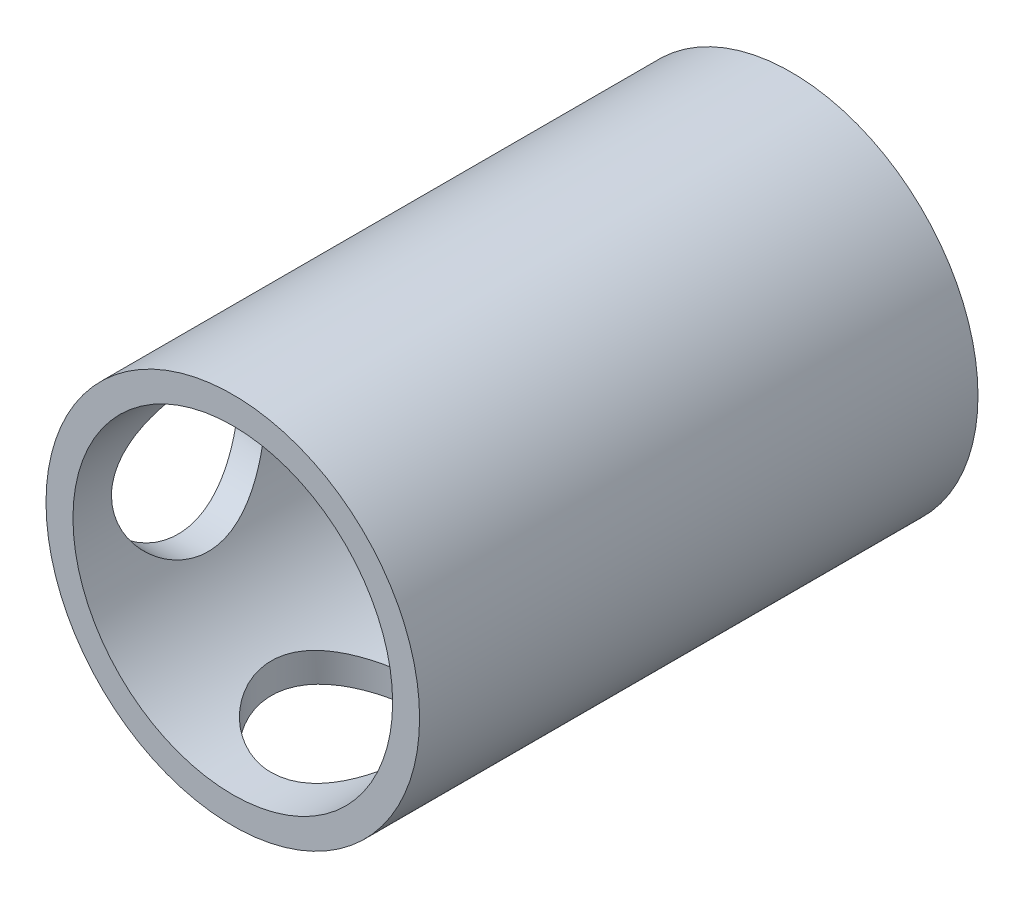
from build123d import *

# Parameters (mm, degrees)
SKETCH3_R           = 4.85
SKETCH3_R_2         = 4.15
BOSS_EXTRUDE1_DEPTH = 14.5
SKETCH4_R           = 2
CUT_EXTRUDE1_DEPTH  = 11.5
SKETCH5_R           = 2
CUT_EXTRUDE2_DEPTH  = 11.5


with BuildPart() as part:
    # Sketch3 → Boss-Extrude1 (new body)
    with BuildSketch(Plane.XY.offset(2)):
        Circle(SKETCH3_R)
        Circle(SKETCH3_R_2, mode=Mode.SUBTRACT)
    extrude(amount=BOSS_EXTRUDE1_DEPTH)

    # Sketch4 → Cut-Extrude1 (cut)
    with BuildSketch(Plane(origin=(-13.41400196, 54.908076208, -66.470187191), x_dir=(0, 1, 0), z_dir=(1, 0, 0))):
        with Locations((-54.908076208, 60.970187191)):
            Circle(SKETCH4_R)
        with Locations(Location((-54.908076208, 79.970187191, 0), (0, 0, 90))):
            Circle(SKETCH4_R)
    extrude(amount=CUT_EXTRUDE1_DEPTH, mode=Mode.SUBTRACT)

    # Sketch5 → Cut-Extrude2 (cut)
    with BuildSketch(Plane(origin=(0, -2, -8.5), x_dir=(1, 0, 0), z_dir=(0, 1, 0))):
        with Locations(Location((0, -22, 0), (0, 0, 270))):
            Circle(SKETCH5_R)
    extrude(amount=-CUT_EXTRUDE2_DEPTH, mode=Mode.SUBTRACT)


solid = part.part
